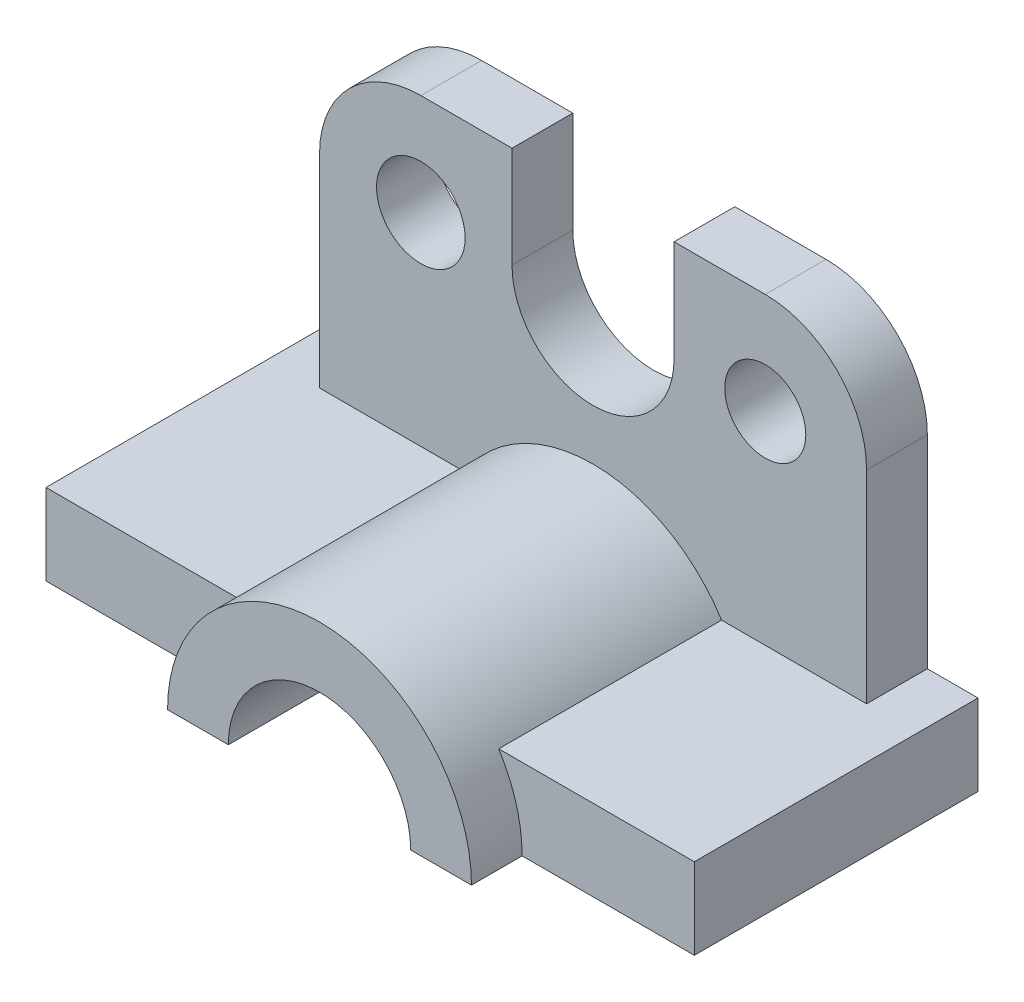
from build123d import *

# Parameters (mm, degrees)
SKETCH_1_W               = 64
SKETCH_1_H               = 28
EXTRUDE_1_DEPTH          = 8
SKETCH_2_W               = 54
SKETCH_2_H               = 6
EXTRUDE_2_DEPTH          = 38
FILLET_1_R               = 10
EXTRUDE_3_DEPTH          = 19
EXTRUDE_3_DEPTH_BACK     = 13
CUT_EXTRUDE_1_DEPTH      = 21
CUT_EXTRUDE_1_DEPTH_BACK = 21
SKETCH_5_R               = 4.372337206
SKETCH_5_R_2             = 4
CUT_EXTRUDE_3_DEPTH      = 100


with BuildPart() as part:
    # 草图1 → 凸台-拉伸1 (new body)
    with BuildSketch(Plane(origin=(0, 0, 0), x_dir=(1, 0, 0), z_dir=(0, 1, 0))):
        Rectangle(SKETCH_1_W, SKETCH_1_H)
    extrude(amount=EXTRUDE_1_DEPTH)

    # 草图2 → 凸台-拉伸2 (add)
    with BuildSketch(Plane(origin=(0, 0, 0), x_dir=(1, 0, 0), z_dir=(0, 1, 0))):
        with Locations((0, 11)):
            Rectangle(SKETCH_2_W, SKETCH_2_H)
    extrude(amount=EXTRUDE_2_DEPTH)

    # 圆角1
    fillet_1_edges = [part.edges().sort_by_distance(p)[0] for p in [
        (-27, 38, -11),
        (27, 38, -11),
    ]]
    fillet(fillet_1_edges, radius=FILLET_1_R)

    # 草图3 → 凸台-拉伸3 (add, two sides: drawn at the far end of the back side and taken through both)
    with BuildSketch(Plane.XY.offset(-EXTRUDE_3_DEPTH_BACK)):
        with BuildLine():
            Line((-15, 0), (15, 0))
            ThreePointArc((15, 0), (0, 15), (-15, 0))
        make_face()
    extrude(amount=EXTRUDE_3_DEPTH + EXTRUDE_3_DEPTH_BACK)

    # 草图4 → 切除-拉伸1 (cut, two sides: drawn at the far end of the back side and taken through both)
    with BuildSketch(Plane.XY.offset(-CUT_EXTRUDE_1_DEPTH_BACK)):
        with BuildLine():
            Line((-9, 0), (9, 0))
            ThreePointArc((9, 0), (0, 9), (-9, 0))
        make_face()
    extrude(amount=CUT_EXTRUDE_1_DEPTH + CUT_EXTRUDE_1_DEPTH_BACK, mode=Mode.SUBTRACT)

    # 草图5 → 切除-拉伸3 (cut)
    with BuildSketch(Plane.XY):
        with Locations((-17, 28)):
            Circle(SKETCH_5_R)
        with Locations((17, 28)):
            Circle(SKETCH_5_R_2)
        with BuildLine():
            Line((-8, 28), (-8, 38))
            Line((-8, 38), (8, 38))
            Line((8, 38), (8, 28))
            ThreePointArc((8, 28), (0, 20), (-8, 28))
        make_face()
    extrude(amount=-CUT_EXTRUDE_3_DEPTH, mode=Mode.SUBTRACT)


solid = part.part
